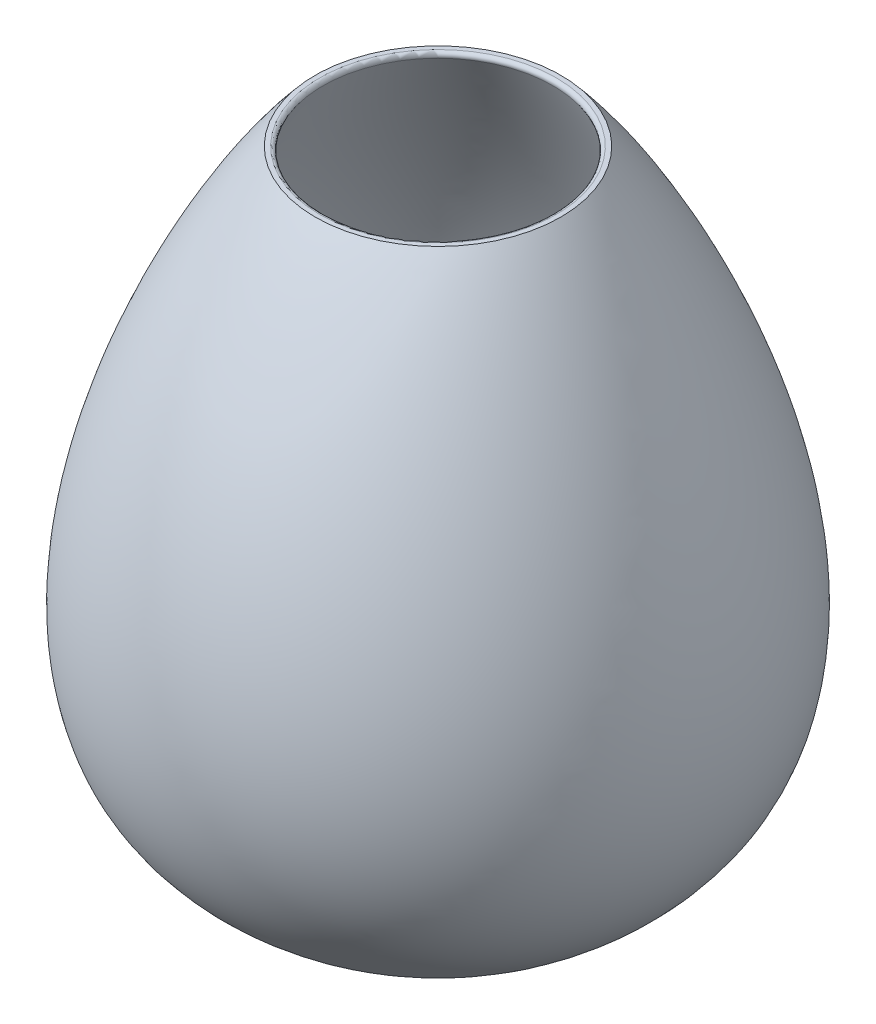
from build123d import *

# Parameters (mm, degrees)
FILLET_1_R = 0.5


with BuildPart() as part:
    # 草图1<2> → 旋转2 (revolve)
    with BuildSketch(Plane.XY):
        with BuildLine():
            add(Edge.make_bspline(
                [(0, 0), (12.40291346, -0.168550615), (56.458757742, 19.398284917), (28.12079665, 77.143490221), (16.99626997, 90)],
                knots=[0, 0, 0, 0, 0.332760321, 1, 1, 1, 1], degree=3))
            Line((16.99626997, 90), (15.546652901, 90))
            add(Edge.make_bspline(
                [(15.546652901, 90), (21.422394386, 78.752220542), (30.982118984, 60.2072392), (32.643445197, 23.72890558), (9.985955992, 13.982099017), (0, 14.627594365)],
                knots=[0, 0, 0, 0, 0.38914613, 0.673136551, 1, 1, 1, 1], degree=3))
            Line((0, 14.627594365), (0, 0))
        make_face()
    revolve(axis=Axis((0, 116.433118832, 0), (0, -1, 0)))

    # 圆角1
    fillet_1_edges = [part.edges().sort_by_distance(p)[0] for p in [
        (-15.546652901, 90, 0),
    ]]
    fillet(fillet_1_edges, radius=FILLET_1_R)


solid = part.part
